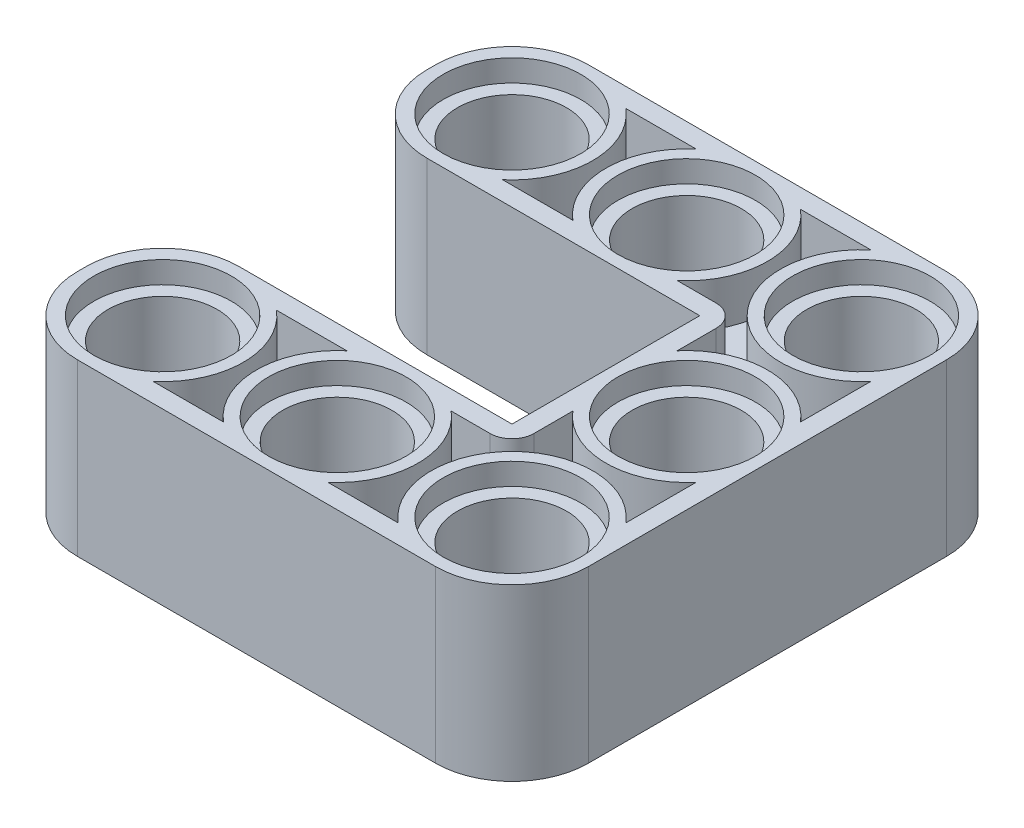
from build123d import *

# Parameters (mm, degrees)
EXTRUDE_1_DEPTH                    = 7.8
CUT_EXTRUDE_1_REACH                = 29.3
SKETCH_1_3_R                       = 2.5
SKETCH_1_4_R                       = 3.15
SKETCH_1_4_R_2                     = 2.5
CUT_EXTRUDE_2_DEPTH                = 1
CUT_EXTRUDE_START                  = 6.8
SKETCH_1_5_R                       = 3.15
SKETCH_1_5_R_2                     = 2.5
CUT_EXTRUDE_3_DEPTH                = 1
PATTERN_LINEAR_3_COUNT             = 3
PATTERN_LINEAR_3_PITCH             = 8
PATTERN_LINEAR_4_COUNT             = 3
PATTERN_LINEAR_4_PITCH             = 8
PATTERN_LINEAR_5_COPY_1_REACH      = 29.3
PATTERN_LINEAR_5_COPY_1_SKETCH_R   = 2.5
PATTERN_LINEAR_5_COPY_2_REACH      = 29.3
PATTERN_LINEAR_5_COPY_2_SKETCH_R   = 2.5
PATTERN_LINEAR_5_COPY_3_SKETCH_R   = 3.15
PATTERN_LINEAR_5_COPY_3_SKETCH_R_2 = 2.5
PATTERN_LINEAR_5_COPY_3_DEPTH      = 1
PATTERN_LINEAR_5_COPY_4_SKETCH_R   = 3.15
PATTERN_LINEAR_5_COPY_4_SKETCH_R_2 = 2.5
PATTERN_LINEAR_5_COPY_4_DEPTH      = 1
PATTERN_START                      = 6.8
PATTERN_LINEAR_5_COPY_5_SKETCH_R   = 3.15
PATTERN_LINEAR_5_COPY_5_SKETCH_R_2 = 2.5
PATTERN_LINEAR_5_COPY_5_DEPTH      = 1
PATTERN_LINEAR_5_COPY_6_SKETCH_R   = 3.15
PATTERN_LINEAR_5_COPY_6_SKETCH_R_2 = 2.5
PATTERN_LINEAR_5_COPY_6_DEPTH      = 1
CUT_EXTRUDE_4_DEPTH                = 2
CUT_EXTRUDE_START_2                = -5.8
CUT_EXTRUDE_5_DEPTH                = 2
PATTERN_LINEAR_6_COUNT             = 2
PATTERN_LINEAR_6_PITCH             = 16
CUT_EXTRUDE_6_DEPTH                = 2
CUT_EXTRUDE_7_DEPTH                = 2
PATTERN_LINEAR_7_COUNT             = 2
PATTERN_LINEAR_7_PITCH             = 8
FILLET_2_R                         = 1
FILLET_3_R                         = 3.5
PATTERN_LINEAR_8_COUNT             = 2
PATTERN_LINEAR_8_PITCH             = 8
PATTERN_LINEAR_8_COPY_1_DEPTH      = 2
PATTERN_START_2                    = -5.8
PATTERN_LINEAR_8_COPY_2_DEPTH      = 2


with BuildPart() as part:
    # 草图1 → 凸台-拉伸1 (new body)
    with BuildSketch(Plane(origin=(0, 0, 0), x_dir=(1, 0, 0), z_dir=(0, 1, 0))):
        Polygon((-23.4, 11.7), (-23.4, 4.3), (-7.4, 4.3), (-7.4, -4.3), (-23.4, -4.3), (-23.4, -11.7), (0, -11.7), (0, 11.7), align=None)
    extrude(amount=EXTRUDE_1_DEPTH)

    # 草图1<3> → 切除-拉伸1 (cut, up to next)
    with BuildSketch(Plane(origin=(0, 0, 0), x_dir=(1, 0, 0), z_dir=(0, 1, 0)), mode=Mode.PRIVATE) as cut_extrude_1_sk1:
        with Locations(Location((-3.7, 8, 0), (0, 0, 270))):
            Circle(SKETCH_1_3_R)
    cut_extrude_1_tool1 = extrude(cut_extrude_1_sk1.sketch, amount=CUT_EXTRUDE_1_REACH, mode=Mode.PRIVATE) & part.part
    cut_extrude_1 = cut_extrude_1_tool1.solids().sort_by_distance((-3.7, 0, -8))[0]
    add(cut_extrude_1, mode=Mode.SUBTRACT)

    # 草图1<4> → 切除-拉伸2 (cut)
    with BuildSketch(Plane(origin=(0, 0, 0), x_dir=(1, 0, 0), z_dir=(0, 1, 0))):
        with Locations(Location((-3.7, 8, 0), (0, 0, 270))):
            Circle(SKETCH_1_4_R)
        with Locations(Location((-3.7, 8, 0), (0, 0, 270))):
            Circle(SKETCH_1_4_R_2, mode=Mode.SUBTRACT)
    cut_extrude_2 = extrude(amount=CUT_EXTRUDE_2_DEPTH, mode=Mode.SUBTRACT)

    # 草图1<5> → 切除-拉伸3 (cut)
    with BuildSketch(Plane(origin=(0, 0, 0), x_dir=(1, 0, 0), z_dir=(0, 1, 0)).offset(CUT_EXTRUDE_START)):
        with Locations(Location((-3.7, 8, 0), (0, 0, 270))):
            Circle(SKETCH_1_5_R)
        with Locations(Location((-3.7, 8, 0), (0, 0, 270))):
            Circle(SKETCH_1_5_R_2, mode=Mode.SUBTRACT)
    cut_extrude_3 = extrude(amount=CUT_EXTRUDE_3_DEPTH, mode=Mode.SUBTRACT)

    # 阵列(线性)3: 切除-拉伸1, 切除-拉伸2, 切除-拉伸3 ×3
    with Locations(*[(-i * PATTERN_LINEAR_3_PITCH, 0, 0) for i in range(1, PATTERN_LINEAR_3_COUNT)]):
        add(cut_extrude_1, mode=Mode.SUBTRACT)
        add(cut_extrude_2, mode=Mode.SUBTRACT)
        add(cut_extrude_3, mode=Mode.SUBTRACT)

    # 阵列(线性)4: 切除-拉伸1, 切除-拉伸2, 切除-拉伸3 ×3
    with Locations(*[(0, 0, i * PATTERN_LINEAR_4_PITCH) for i in range(1, PATTERN_LINEAR_4_COUNT)]):
        add(cut_extrude_1, mode=Mode.SUBTRACT)
        add(cut_extrude_2, mode=Mode.SUBTRACT)
        add(cut_extrude_3, mode=Mode.SUBTRACT)

    # 阵列(线性)5 copy 1 sketch → 阵列(线性)5 copy 1 (cut, up to next)
    with BuildSketch(Plane(origin=(-8, 0, 16), x_dir=(1, 0, 0), z_dir=(0, 1, 0)), mode=Mode.PRIVATE) as pattern_linear_5_copy_1_sk1:
        with Locations(Location((-3.7, 8, 0), (0, 0, 270))):
            Circle(PATTERN_LINEAR_5_COPY_1_SKETCH_R)
    pattern_linear_5_copy_1_tool1 = extrude(pattern_linear_5_copy_1_sk1.sketch, amount=PATTERN_LINEAR_5_COPY_1_REACH, mode=Mode.PRIVATE) & part.part
    add(pattern_linear_5_copy_1_tool1.solids().sort_by_distance((-11.7, 0, 8))[0], mode=Mode.SUBTRACT)

    # 阵列(线性)5 copy 2 sketch → 阵列(线性)5 copy 2 (cut, up to next)
    with BuildSketch(Plane(origin=(-16, 0, 16), x_dir=(1, 0, 0), z_dir=(0, 1, 0)), mode=Mode.PRIVATE) as pattern_linear_5_copy_2_sk1:
        with Locations(Location((-3.7, 8, 0), (0, 0, 270))):
            Circle(PATTERN_LINEAR_5_COPY_2_SKETCH_R)
    pattern_linear_5_copy_2_tool1 = extrude(pattern_linear_5_copy_2_sk1.sketch, amount=PATTERN_LINEAR_5_COPY_2_REACH, mode=Mode.PRIVATE) & part.part
    add(pattern_linear_5_copy_2_tool1.solids().sort_by_distance((-19.7, 0, 8))[0], mode=Mode.SUBTRACT)

    # 阵列(线性)5 copy 3 sketch → 阵列(线性)5 copy 3 (cut)
    with BuildSketch(Plane(origin=(-8, 0, 16), x_dir=(1, 0, 0), z_dir=(0, 1, 0))):
        with Locations(Location((-3.7, 8, 0), (0, 0, 270))):
            Circle(PATTERN_LINEAR_5_COPY_3_SKETCH_R)
        with Locations(Location((-3.7, 8, 0), (0, 0, 270))):
            Circle(PATTERN_LINEAR_5_COPY_3_SKETCH_R_2, mode=Mode.SUBTRACT)
    extrude(amount=PATTERN_LINEAR_5_COPY_3_DEPTH, mode=Mode.SUBTRACT)

    # 阵列(线性)5 copy 4 sketch → 阵列(线性)5 copy 4 (cut)
    with BuildSketch(Plane(origin=(-16, 0, 16), x_dir=(1, 0, 0), z_dir=(0, 1, 0))):
        with Locations(Location((-3.7, 8, 0), (0, 0, 270))):
            Circle(PATTERN_LINEAR_5_COPY_4_SKETCH_R)
        with Locations(Location((-3.7, 8, 0), (0, 0, 270))):
            Circle(PATTERN_LINEAR_5_COPY_4_SKETCH_R_2, mode=Mode.SUBTRACT)
    extrude(amount=PATTERN_LINEAR_5_COPY_4_DEPTH, mode=Mode.SUBTRACT)

    # 阵列(线性)5 copy 5 sketch → 阵列(线性)5 copy 5 (cut)
    with BuildSketch(Plane(origin=(-8, 0, 16), x_dir=(1, 0, 0), z_dir=(0, 1, 0)).offset(PATTERN_START)):
        with Locations(Location((-3.7, 8, 0), (0, 0, 270))):
            Circle(PATTERN_LINEAR_5_COPY_5_SKETCH_R)
        with Locations(Location((-3.7, 8, 0), (0, 0, 270))):
            Circle(PATTERN_LINEAR_5_COPY_5_SKETCH_R_2, mode=Mode.SUBTRACT)
    extrude(amount=PATTERN_LINEAR_5_COPY_5_DEPTH, mode=Mode.SUBTRACT)

    # 阵列(线性)5 copy 6 sketch → 阵列(线性)5 copy 6 (cut)
    with BuildSketch(Plane(origin=(-16, 0, 16), x_dir=(1, 0, 0), z_dir=(0, 1, 0)).offset(PATTERN_START)):
        with Locations(Location((-3.7, 8, 0), (0, 0, 270))):
            Circle(PATTERN_LINEAR_5_COPY_6_SKETCH_R)
        with Locations(Location((-3.7, 8, 0), (0, 0, 270))):
            Circle(PATTERN_LINEAR_5_COPY_6_SKETCH_R_2, mode=Mode.SUBTRACT)
    extrude(amount=PATTERN_LINEAR_5_COPY_6_DEPTH, mode=Mode.SUBTRACT)

    # 草图3 → 切除-拉伸4 (cut)
    with BuildSketch(Plane.XZ):
        with BuildLine():
            ThreePointArc((-6.525, 5.610570152), (-7.387158706, 8.307994608), (-6.089429848, 10.825))
            Line((-6.089429848, 10.825), (-9.310570152, 10.825))
            ThreePointArc((-9.310570152, 10.825), (-8.343596386, 9.557098192), (-8, 8))
            ThreePointArc((-8, 8), (-8.343596386, 6.442901808), (-9.310570152, 5.175))
            Line((-9.310570152, 5.175), (-6.525, 5.175))
            Line((-6.525, 5.175), (-6.525, 5.610570152))
        make_face()
        with BuildLine():
            ThreePointArc((-6.089429848, 5.175), (-6.31629509, 5.38370491), (-6.525, 5.610570152))
            Line((-6.525, 5.610570152), (-6.525, 5.175))
            Line((-6.525, 5.175), (-6.089429848, 5.175))
        make_face()
    cut_extrude_4 = extrude(amount=-CUT_EXTRUDE_4_DEPTH, mode=Mode.SUBTRACT)

    # 草图3<3> → 切除-拉伸5 (cut)
    with BuildSketch(Plane.XZ.offset(CUT_EXTRUDE_START_2)):
        with BuildLine():
            ThreePointArc((-6.525, 5.610570152), (-7.387158706, 8.307994608), (-6.089429848, 10.825))
            Line((-6.089429848, 10.825), (-9.310570152, 10.825))
            ThreePointArc((-9.310570152, 10.825), (-8.343596386, 9.557098192), (-8, 8))
            ThreePointArc((-8, 8), (-8.343596386, 6.442901808), (-9.310570152, 5.175))
            Line((-9.310570152, 5.175), (-6.525, 5.175))
            Line((-6.525, 5.175), (-6.525, 5.610570152))
        make_face()
        with BuildLine():
            ThreePointArc((-6.089429848, 5.175), (-6.31629509, 5.38370491), (-6.525, 5.610570152))
            Line((-6.525, 5.610570152), (-6.525, 5.175))
            Line((-6.525, 5.175), (-6.089429848, 5.175))
        make_face()
    cut_extrude_5 = extrude(amount=-CUT_EXTRUDE_5_DEPTH, mode=Mode.SUBTRACT)

    # 阵列(线性)6: 切除-拉伸4, 切除-拉伸5 ×2
    with Locations(*[(0, 0, -i * PATTERN_LINEAR_6_PITCH) for i in range(1, PATTERN_LINEAR_6_COUNT)]):
        add(cut_extrude_4, mode=Mode.SUBTRACT)
        add(cut_extrude_5, mode=Mode.SUBTRACT)

    # 草图3<4> → 切除-拉伸6 (cut)
    with BuildSketch(Plane.XZ):
        with BuildLine():
            Line((-0.875, 2.389429848), (-0.875, 5.610570152))
            ThreePointArc((-0.875, 5.610570152), (-3.392005392, 4.312841294), (-6.089429848, 5.175))
            Line((-6.089429848, 5.175), (-6.525, 5.175))
            Line((-6.525, 5.175), (-6.525, 2.389429848))
            ThreePointArc((-6.525, 2.389429848), (-3.7, 3.7), (-0.875, 2.389429848))
        make_face()
        with BuildLine():
            ThreePointArc((-6.089429848, 5.175), (-6.31629509, 5.38370491), (-6.525, 5.610570152))
            Line((-6.525, 5.610570152), (-6.525, 5.175))
            Line((-6.525, 5.175), (-6.089429848, 5.175))
        make_face()
    cut_extrude_6 = extrude(amount=-CUT_EXTRUDE_6_DEPTH, mode=Mode.SUBTRACT)

    # 草图3<5> → 切除-拉伸7 (cut)
    with BuildSketch(Plane.XZ.offset(CUT_EXTRUDE_START_2)):
        with BuildLine():
            Line((-0.875, 2.389429848), (-0.875, 5.610570152))
            ThreePointArc((-0.875, 5.610570152), (-3.392005392, 4.312841294), (-6.089429848, 5.175))
            Line((-6.089429848, 5.175), (-6.525, 5.175))
            Line((-6.525, 5.175), (-6.525, 2.389429848))
            ThreePointArc((-6.525, 2.389429848), (-3.7, 3.7), (-0.875, 2.389429848))
        make_face()
        with BuildLine():
            ThreePointArc((-6.089429848, 5.175), (-6.31629509, 5.38370491), (-6.525, 5.610570152))
            Line((-6.525, 5.610570152), (-6.525, 5.175))
            Line((-6.525, 5.175), (-6.089429848, 5.175))
        make_face()
    cut_extrude_7 = extrude(amount=-CUT_EXTRUDE_7_DEPTH, mode=Mode.SUBTRACT)

    # 阵列(线性)7: 切除-拉伸6, 切除-拉伸7 ×2
    with Locations(*[(0, 0, -i * PATTERN_LINEAR_7_PITCH) for i in range(1, PATTERN_LINEAR_7_COUNT)]):
        add(cut_extrude_6, mode=Mode.SUBTRACT)
        add(cut_extrude_7, mode=Mode.SUBTRACT)

    # 圆角2
    fillet_2_edges = [part.edges().sort_by_distance(p)[0] for p in [
        (-6.525, 1, 5.175),
        (-6.525, 6.8, 5.175),
        (-6.525, 1, -5.175),
        (-6.525, 6.8, -5.175),
    ]]
    fillet(fillet_2_edges, radius=FILLET_2_R)

    # 圆角3
    fillet_3_edges = [part.edges().sort_by_distance(p)[0] for p in [
        (0, 3.9, 11.7),
        (-23.4, 3.9, 11.7),
        (-23.4, 3.9, 4.3),
        (0, 3.9, -11.7),
        (-23.4, 3.9, -11.7),
        (-23.4, 3.9, -4.3),
    ]]
    fillet(fillet_3_edges, radius=FILLET_3_R)

    # 阵列(线性)8: 切除-拉伸4, 切除-拉伸5 ×2
    with Locations(*[(-i * PATTERN_LINEAR_8_PITCH, 0, 0) for i in range(1, PATTERN_LINEAR_8_COUNT)]):
        add(cut_extrude_4, mode=Mode.SUBTRACT)
        add(cut_extrude_5, mode=Mode.SUBTRACT)

    # 阵列(线性)8 copy 1 sketch → 阵列(线性)8 copy 1 (cut)
    with BuildSketch(Plane(origin=(-8, 0, -16), x_dir=(1, 0, 0), z_dir=(0, -1, 0))):
        with BuildLine():
            ThreePointArc((-6.525, 5.610570152), (-7.387158706, 8.307994608), (-6.089429848, 10.825))
            Line((-6.089429848, 10.825), (-9.310570152, 10.825))
            ThreePointArc((-9.310570152, 10.825), (-8.343596386, 9.557098192), (-8, 8))
            ThreePointArc((-8, 8), (-8.343596386, 6.442901808), (-9.310570152, 5.175))
            Line((-9.310570152, 5.175), (-6.525, 5.175))
            Line((-6.525, 5.175), (-6.525, 5.610570152))
        make_face()
        with BuildLine():
            ThreePointArc((-6.089429848, 5.175), (-6.31629509, 5.38370491), (-6.525, 5.610570152))
            Line((-6.525, 5.610570152), (-6.525, 5.175))
            Line((-6.525, 5.175), (-6.089429848, 5.175))
        make_face()
    extrude(amount=-PATTERN_LINEAR_8_COPY_1_DEPTH, mode=Mode.SUBTRACT)

    # 阵列(线性)8 copy 2 sketch → 阵列(线性)8 copy 2 (cut)
    with BuildSketch(Plane(origin=(-8, 0, -16), x_dir=(1, 0, 0), z_dir=(0, -1, 0)).offset(PATTERN_START_2)):
        with BuildLine():
            ThreePointArc((-6.525, 5.610570152), (-7.387158706, 8.307994608), (-6.089429848, 10.825))
            Line((-6.089429848, 10.825), (-9.310570152, 10.825))
            ThreePointArc((-9.310570152, 10.825), (-8.343596386, 9.557098192), (-8, 8))
            ThreePointArc((-8, 8), (-8.343596386, 6.442901808), (-9.310570152, 5.175))
            Line((-9.310570152, 5.175), (-6.525, 5.175))
            Line((-6.525, 5.175), (-6.525, 5.610570152))
        make_face()
        with BuildLine():
            ThreePointArc((-6.089429848, 5.175), (-6.31629509, 5.38370491), (-6.525, 5.610570152))
            Line((-6.525, 5.610570152), (-6.525, 5.175))
            Line((-6.525, 5.175), (-6.089429848, 5.175))
        make_face()
    extrude(amount=-PATTERN_LINEAR_8_COPY_2_DEPTH, mode=Mode.SUBTRACT)


solid = part.part
